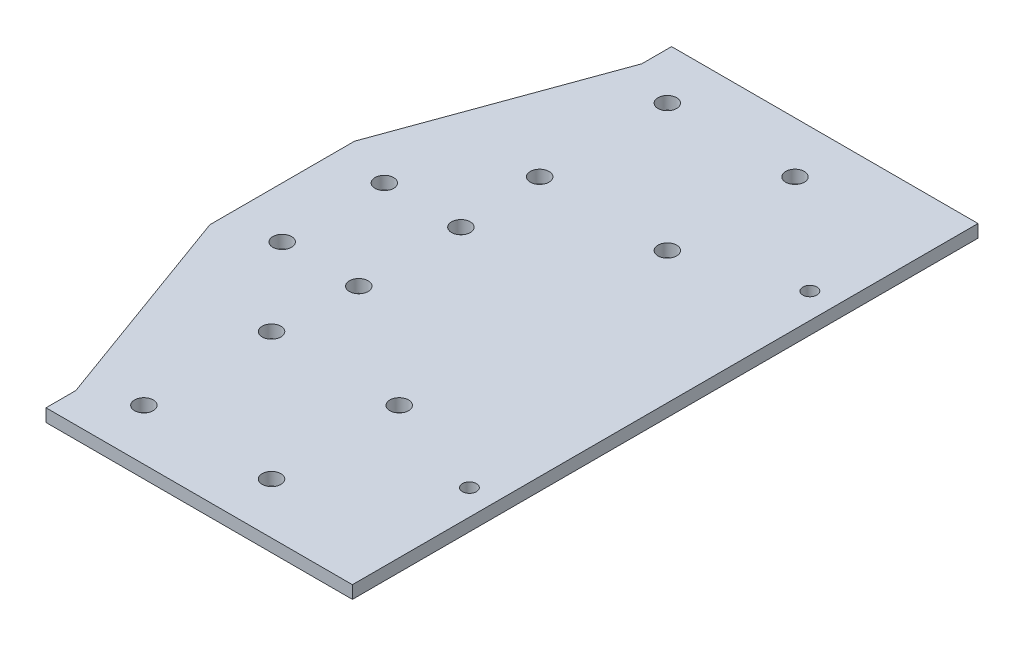
from build123d import *

# Parameters (mm, degrees)
EXTRUDE_1_DEPTH     = 3
SKETCH_2_R          = 2.2
SKETCH_2_R_2        = 1.65
CUT_EXTRUDE_1_DEPTH = 10


with BuildPart() as part:
    # 草图1 → 凸台-拉伸1 (new body)
    with BuildSketch(Plane(origin=(0, 0, 0), x_dir=(1, 0, 0), z_dir=(0, 1, 0))):
        Polygon((0, 0), (29.84652885, 0), (29.84652885, 147), (0, 147), (-42.15347115, 147), (-42.15347115, 140), (-60.15347115, 90.5), (-60.15347115, 56.5), (-42.15347115, 7), (-42.15347115, 0), align=None)
    extrude(amount=EXTRUDE_1_DEPTH)

    # 草图2 → 切除-拉伸1 (cut)
    with BuildSketch(Plane(origin=(0, 3, 0), x_dir=(1, 0, 0), z_dir=(0, 1, 0))):
        with Locations(Location((-48.15347115, 85.5, 0), (0, 0, 270))):
            Circle(SKETCH_2_R)
        with Locations(Location((-30.15347115, 85.5, 0), (0, 0, 270))):
            Circle(SKETCH_2_R)
        with Locations(Location((-30.15347115, 61.5, 0), (0, 0, 270))):
            Circle(SKETCH_2_R)
        with Locations(Location((-48.15347115, 61.5, 0), (0, 0, 270))):
            Circle(SKETCH_2_R)
        with Locations(Location((-1.15347115, 135, 0), (0, 0, 270))):
            Circle(SKETCH_2_R)
        with Locations(Location((-1.15347115, 105, 0), (0, 0, 270))):
            Circle(SKETCH_2_R)
        with Locations(Location((-31.15347115, 135, 0), (0, 0, 270))):
            Circle(SKETCH_2_R)
        with Locations(Location((-31.15347115, 105, 0), (0, 0, 270))):
            Circle(SKETCH_2_R)
        with Locations(Location((-31.15347115, 42, 0), (0, 0, 270))):
            Circle(SKETCH_2_R)
        with Locations(Location((-31.15347115, 12, 0), (0, 0, 270))):
            Circle(SKETCH_2_R)
        with Locations(Location((-1.15347115, 42, 0), (0, 0, 270))):
            Circle(SKETCH_2_R)
        with Locations(Location((-1.15347115, 12, 0), (0, 0, 270))):
            Circle(SKETCH_2_R)
        with Locations(Location((23.84652885, 113.5, 0), (0, 0, 270))):
            Circle(SKETCH_2_R_2)
        with Locations(Location((23.84652885, 33.5, 0), (0, 0, 270))):
            Circle(SKETCH_2_R_2)
    extrude(amount=-CUT_EXTRUDE_1_DEPTH, mode=Mode.SUBTRACT)


solid = part.part
